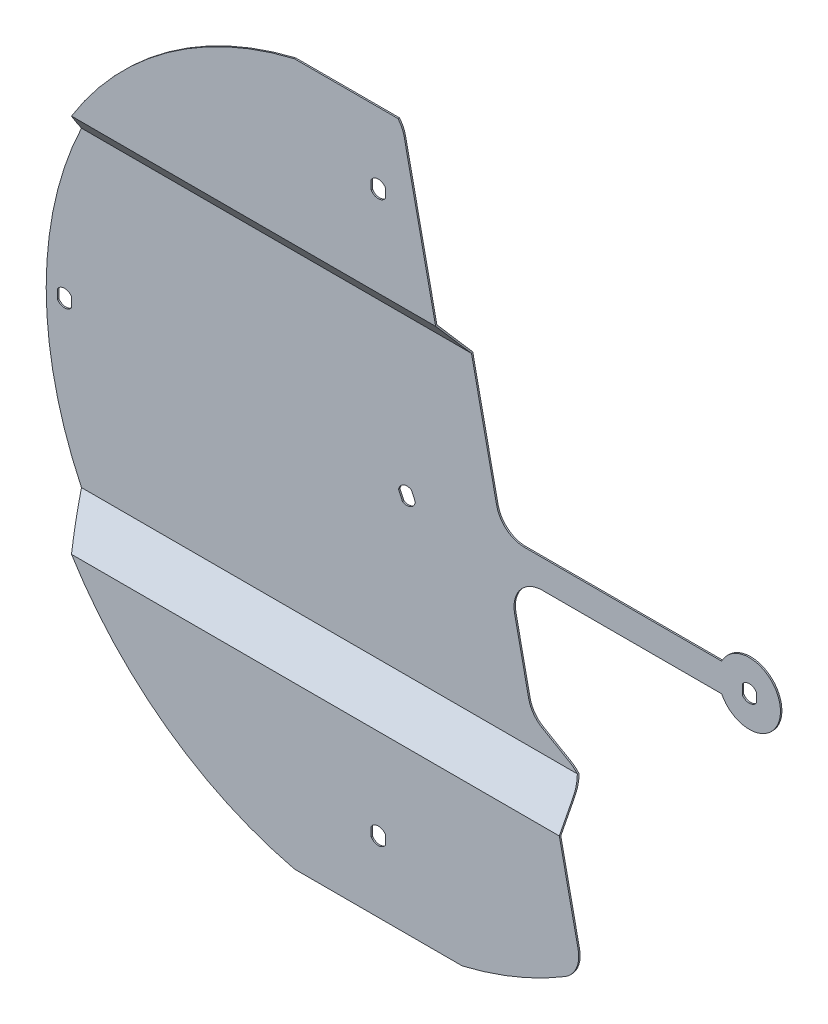
from build123d import *

# Parameters (mm, degrees)
SALIENTE_EXTRUIR1_DEPTH    = 271
CORTAR_EXTRUIR6_DEPTH      = 372.705950862
CORTAR_EXTRUIR6_DEPTH_BACK = 372.705950862
CROQUIS2_W                 = 769.435607064
CROQUIS2_H                 = 651.661171996
CORTAR_EXTRUIR9_DEPTH      = 367.633759911
CORTAR_EXTRUIR9_DEPTH_BACK = 367.633759911


with BuildPart() as part:
    # Croquis1 → Saliente-Extruir1 (new, symmetric)
    with BuildSketch(Plane(origin=(0, 0, 0), x_dir=(0, 0, -1), z_dir=(1, 0, 0))):
        Polygon((-36.5, -110), (-36.5, 110), (-56.747809705, 134.130399958), (-56.747809705, 248), (-55.747809705, 248), (-55.747809705, 134.494370193), (-35.5, 110.363970234), (-35.5, -110.363970234), (-55.747809705, -134.494370193), (-55.747809705, -248), (-56.747809705, -248), (-56.747809705, -134.130399958), align=None)
    extrude(amount=SALIENTE_EXTRUIR1_DEPTH, both=True)

    # Croquis2 → Cortar-Extruir6 (cut, two sides: drawn at the far end of the back side and taken through both)
    with BuildSketch(Plane.XY.offset(-CORTAR_EXTRUIR6_DEPTH_BACK)):
        Rectangle(CROQUIS2_W, CROQUIS2_H)
        with BuildLine():
            ThreePointArc((18.264078831, 239.138091094), (11.247490428, 250.568826506), (-1.413221116, 254.996083903))
            ThreePointArc((-1.413221116, 254.996083903), (-245.428142449, -69.210020185), (132.017150423, -218.166156849))
            ThreePointArc((132.017150423, -218.166156849), (140.013145358, -209.009152502), (141.22932319, -196.913385678))
            Line((141.22932319, -196.913385678), (124.678167335, -118.72145722))
            ThreePointArc((124.678167335, -118.72145722), (121.297013967, -111.114290122), (115.11170826, -105.54264919))
            Line((115.11170826, -105.54264919), (95.618429873, -94.288199666))
            ThreePointArc((95.618429873, -94.288199666), (89.433124166, -88.716558735), (86.051970798, -81.109391636))
            Line((86.051970798, -81.109391636), (76.110157122, -34.141700046))
            ThreePointArc((76.110157122, -34.141700046), (80.139016625, -17.407025787), (95.676616197, -10))
            Line((95.676616197, -10), (222.404082058, -10))
            ThreePointArc((222.404082058, -10), (264, 0), (222.404082058, 10))
            Line((222.404082058, 10), (82.976208739, 10))
            ThreePointArc((82.976208739, 10), (70.383234525, 14.462400428), (63.409749664, 25.858299954))
            Line((63.409749664, 25.858299954), (18.264078831, 239.138091094))
        make_face(mode=Mode.SUBTRACT)
    extrude(amount=CORTAR_EXTRUIR6_DEPTH + CORTAR_EXTRUIR6_DEPTH_BACK, mode=Mode.SUBTRACT)

    # Croquis4 → Cortar-Extruir9 (cut, two sides: drawn at the far end of the back side and taken through both)
    with BuildSketch(Plane.XY.offset(-CORTAR_EXTRUIR9_DEPTH_BACK)):
        with BuildLine():
            Line((-5, 201.31662479), (-5, 194.68337521))
            ThreePointArc((-5, 194.68337521), (0, 192), (5, 194.68337521))
            Line((5, 194.68337521), (5, 201.31662479))
            ThreePointArc((5, 201.31662479), (0, 204), (-5, 201.31662479))
        make_face()
        with BuildLine():
            Line((5, -201.31662479), (5, -194.68337521))
            ThreePointArc((5, -194.68337521), (0, -192), (-5, -194.68337521))
            Line((-5, -194.68337521), (-5, -201.31662479))
            ThreePointArc((-5, -201.31662479), (0, -204), (5, -201.31662479))
        make_face()
        with BuildLine():
            Line((-247, 3.31662479), (-247, -3.31662479))
            ThreePointArc((-247, -3.31662479), (-242, -6), (-237, -3.31662479))
            Line((-237, -3.31662479), (-237, 3.31662479))
            ThreePointArc((-237, 3.31662479), (-242, 6), (-247, 3.31662479))
        make_face()
        with BuildLine():
            Line((237, 3.31662479), (237, -3.31662479))
            ThreePointArc((237, -3.31662479), (242, -6), (247, -3.31662479))
            Line((247, -3.31662479), (247, 3.31662479))
            ThreePointArc((247, 3.31662479), (242, 6), (237, 3.31662479))
        make_face()
        with BuildLine():
            Line((-5.933205139, 0.892791565), (-3.129872731, -5.118974183))
            ThreePointArc((-3.129872731, -5.118974183), (2.53570957, -5.437846722), (5.933205139, -0.892791565))
            Line((5.933205139, -0.892791565), (3.129872731, 5.118974183))
            ThreePointArc((3.129872731, 5.118974183), (-2.53570957, 5.437846722), (-5.933205139, 0.892791565))
        make_face()
    extrude(amount=CORTAR_EXTRUIR9_DEPTH + CORTAR_EXTRUIR9_DEPTH_BACK, mode=Mode.SUBTRACT)


solid = part.part
